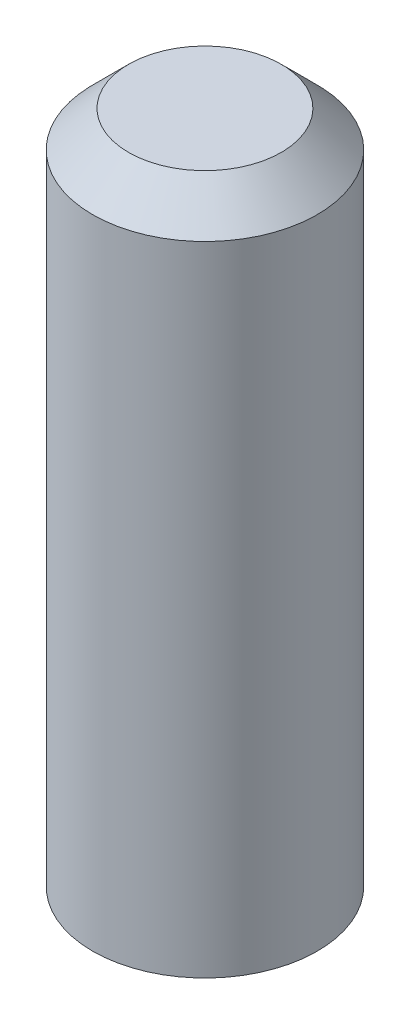
from build123d import *

# Parameters (mm, degrees)
SKETCH1_R           = 2.5
BOSS_EXTRUDE1_DEPTH = 15
CHAMFER1_SIZE       = 0.8


with BuildPart() as part:
    # Sketch1 → Boss-Extrude1 (new body)
    with BuildSketch(Plane(origin=(0, 0, 0), x_dir=(1, 0, 0), z_dir=(0, 1, 0))):
        with Locations(Location((0, 0, 0), (0, 0, 270))):
            Circle(SKETCH1_R)
    extrude(amount=BOSS_EXTRUDE1_DEPTH)

    # Chamfer1
    chamfer1_edges = [part.edges().sort_by_distance(p)[0] for p in [
        (0, 15, -2.5),
    ]]
    chamfer(chamfer1_edges, length=CHAMFER1_SIZE)


solid = part.part
